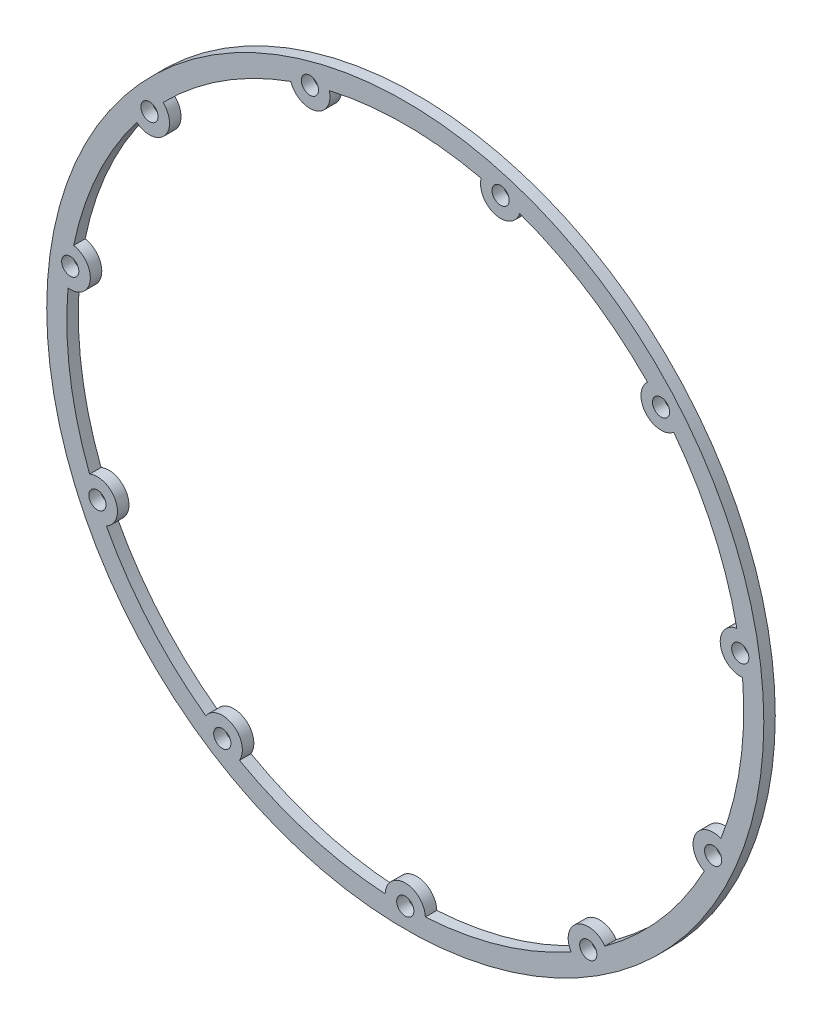
from build123d import *

# Parameters (mm, degrees)
SKETCH_1_R      = 62.5
SKETCH_1_R_2    = 1.5
EXTRUDE_1_DEPTH = 2


with BuildPart() as part:
    # 草图1 → 凸台-拉伸1 (new body)
    with BuildSketch(Plane.XY):
        Circle(SKETCH_1_R)
        with Locations((0, -59)):
            Circle(SKETCH_1_R_2, mode=Mode.SUBTRACT)
        with Locations((-31.89780823, -49.633958437)):
            Circle(SKETCH_1_R_2, mode=Mode.SUBTRACT)
        with Locations((-53.668287726, -24.509485767)):
            Circle(SKETCH_1_R_2, mode=Mode.SUBTRACT)
        with Locations((-58.399465071, 8.396575458)):
            Circle(SKETCH_1_R_2, mode=Mode.SUBTRACT)
        with Locations((-44.589224887, 38.636783303)):
            Circle(SKETCH_1_R_2, mode=Mode.SUBTRACT)
        with Locations((-16.622220854, 56.610085443)):
            Circle(SKETCH_1_R_2, mode=Mode.SUBTRACT)
        with Locations((16.622220854, 56.610085443)):
            Circle(SKETCH_1_R_2, mode=Mode.SUBTRACT)
        with Locations((44.589224887, 38.636783303)):
            Circle(SKETCH_1_R_2, mode=Mode.SUBTRACT)
        with Locations((58.399465071, 8.396575458)):
            Circle(SKETCH_1_R_2, mode=Mode.SUBTRACT)
        with Locations((53.668287726, -24.509485767)):
            Circle(SKETCH_1_R_2, mode=Mode.SUBTRACT)
        with Locations((31.89780823, -49.633958437)):
            Circle(SKETCH_1_R_2, mode=Mode.SUBTRACT)
        with BuildLine():
            ThreePointArc((3.498460053, -58.896186441), (0, -55.5), (-3.498460053, -58.896186441))
            ThreePointArc((-3.498460053, -58.896186441), (-16.622220854, -56.610085443), (-28.898590503, -51.438035217))
            ThreePointArc((-28.898590503, -51.438035217), (-30.005565369, -46.689571072), (-34.784774262, -47.65521461))
            ThreePointArc((-34.784774262, -47.65521461), (-44.589224887, -38.636783303), (-52.120542762, -27.648671255))
            ThreePointArc((-52.120542762, -27.648671255), (-50.484575742, -23.055533222), (-55.027168419, -21.284048857))
            ThreePointArc((-55.027168419, -21.284048857), (-58.399465071, -8.396575458), (-58.794590961, 4.918950474))
            ThreePointArc((-58.794590961, 4.918950474), (-54.935090024, 7.898473524), (-57.798825407, 11.844652023))
            ThreePointArc((-57.798825407, 11.844652023), (-53.668287726, 24.509485767), (-46.801771952, 35.924840183))
            ThreePointArc((-46.801771952, 35.924840183), (-41.944101377, 36.344770734), (-42.219763715, 41.212759575))
            ThreePointArc((-42.219763715, 41.212759575), (-31.89780823, 49.633958437), (-19.949721034, 55.524846967))
            ThreePointArc((-19.949721034, 55.524846967), (-15.636156905, 53.251860036), (-13.236225354, 57.496107158))
            ThreePointArc((-13.236225354, 57.496107158), (0, 59), (13.236225354, 57.496107158))
            ThreePointArc((13.236225354, 57.496107158), (15.636156905, 53.251860036), (19.949721034, 55.524846967))
            ThreePointArc((19.949721034, 55.524846967), (31.89780823, 49.633958437), (42.219763715, 41.212759575))
            ThreePointArc((42.219763715, 41.212759575), (41.944101377, 36.344770734), (46.801771952, 35.924840183))
            ThreePointArc((46.801771952, 35.924840183), (53.668287726, 24.509485767), (57.798825407, 11.844652023))
            ThreePointArc((57.798825407, 11.844652023), (54.935090024, 7.898473524), (58.794590961, 4.918950474))
            ThreePointArc((58.794590961, 4.918950474), (58.399465071, -8.396575458), (55.027168419, -21.284048857))
            ThreePointArc((55.027168419, -21.284048857), (50.484575742, -23.055533222), (52.120542762, -27.648671255))
            ThreePointArc((52.120542762, -27.648671255), (44.589224887, -38.636783303), (34.784774262, -47.65521461))
            ThreePointArc((34.784774262, -47.65521461), (30.005565369, -46.689571072), (28.898590503, -51.438035217))
            ThreePointArc((28.898590503, -51.438035217), (16.622220854, -56.610085443), (3.498460053, -58.896186441))
        make_face(mode=Mode.SUBTRACT)
    extrude(amount=EXTRUDE_1_DEPTH)


solid = part.part
